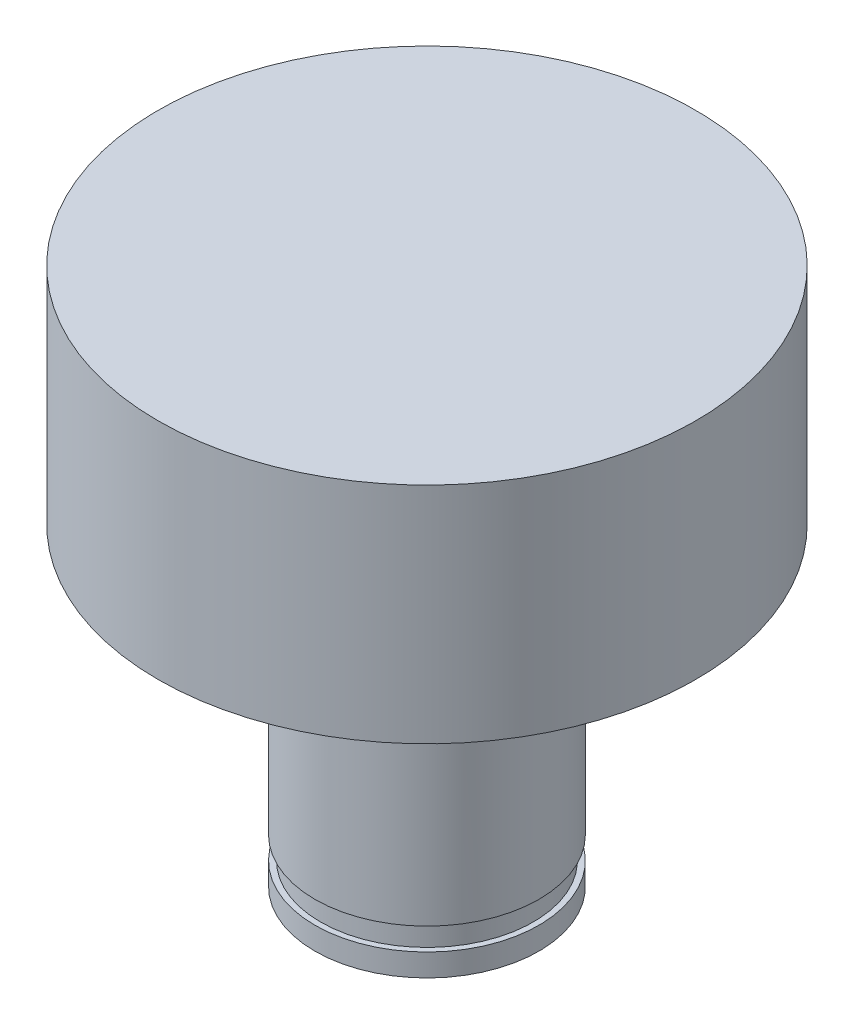
from build123d import *

# Parameters (mm, degrees)
SKETCH1_R           = 6
BOSS_EXTRUDE1_DEPTH = 5
SKETCH2_R           = 2.5
BOSS_EXTRUDE2_DEPTH = 12
SKETCH4_W           = 0.625
SKETCH4_H           = 0.5


with BuildPart() as part:
    # Sketch1 → Boss-Extrude1 (new body)
    with BuildSketch(Plane(origin=(0, 0, 0), x_dir=(1, 0, 0), z_dir=(0, 1, 0))):
        with Locations(Location((0, 0, 0), (0, 0, 270))):
            Circle(SKETCH1_R)
    extrude(amount=BOSS_EXTRUDE1_DEPTH)

    # Sketch2 → Boss-Extrude2 (add)
    with BuildSketch(Plane(origin=(0, 5, 0), x_dir=(-1, 0, 0), z_dir=(0, 1, 0))):
        with Locations(Location((0, 0, 0), (0, 0, 90))):
            Circle(SKETCH2_R)
    extrude(amount=-BOSS_EXTRUDE2_DEPTH)

    # Sketch4 → Groove for ANSI B27.7 - 3AM1-5, Basic External Retaining Ring1 (revolve, cut)
    with BuildSketch(Plane(origin=(0, -7, 0), x_dir=(0, 0, 1), z_dir=(-1, 0, 0))):
        with Locations((2.6875, 0.751696416)):
            Rectangle(SKETCH4_W, SKETCH4_H)
    revolve(axis=Axis((0, -57, 0), (0, 1, 0)), mode=Mode.SUBTRACT)


solid = part.part
